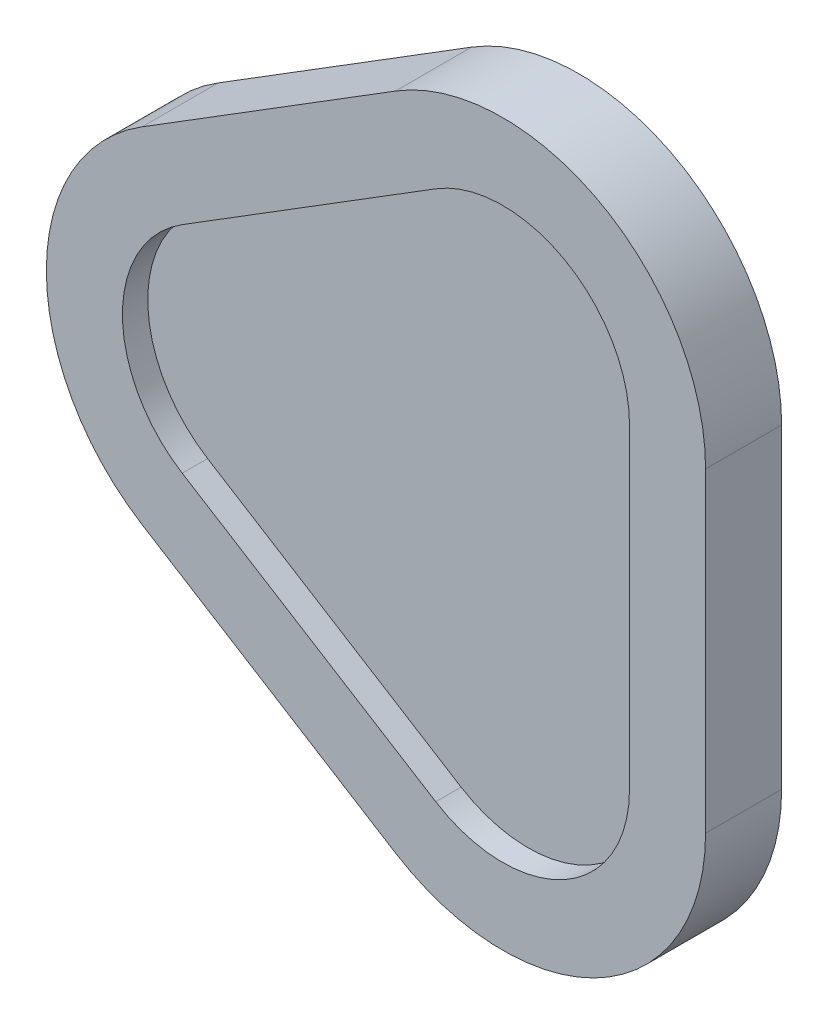
from build123d import *

# Parameters (mm, degrees)
Y_KSEKLIK_EKSTR_ZYON1_DEPTH = 15
BOSS_EXTRUDE1_DEPTH         = 10


with BuildPart() as part:
    # Çizim1 → Yükseklik-Ekstrüzyon1 (new body)
    with BuildSketch(Plane.XY):
        with BuildLine():
            Line((-90.996604912, -49.609404393), (-40.996604912, -80.724218798))
            ThreePointArc((-40.996604912, -80.724218798), (-0.437932375, -81.729892604), (20.137283846, -46.763082981))
            Line((20.137283846, -46.763082981), (20.137283846, 15.466545829))
            ThreePointArc((20.137283846, 15.466545829), (-0.437932375, 50.433355451), (-40.996604912, 49.427681645))
            Line((-40.996604912, 49.427681645), (-90.996604912, 18.31286724))
            ThreePointArc((-90.996604912, 18.31286724), (-109.862716154, -15.648268576), (-90.996604912, -49.609404393))
        make_face()
        with BuildLine():
            Line((-83.071396628, -36.873978462), (-33.071396628, -67.988792867))
            ThreePointArc((-33.071396628, -67.988792867), (-7.722226292, -68.617338995), (5.137283846, -46.763082981))
            Line((5.137283846, -46.763082981), (5.137283846, 15.466545829))
            ThreePointArc((5.137283846, 15.466545829), (-7.722226292, 37.320801843), (-33.071396628, 36.692255714))
            Line((-33.071396628, 36.692255714), (-83.071396628, 5.577441309))
            ThreePointArc((-83.071396628, 5.577441309), (-94.862716154, -15.648268576), (-83.071396628, -36.873978462))
        make_face(mode=Mode.SUBTRACT)
    extrude(amount=Y_KSEKLIK_EKSTR_ZYON1_DEPTH)

    # Çizim1<3> → Boss-Extrude1 (add)
    with BuildSketch(Plane.XY):
        with BuildLine():
            ThreePointArc((-83.071396628, 5.577441309), (-94.862716154, -15.648268576), (-83.071396628, -36.873978462))
            Line((-83.071396628, -36.873978462), (-33.071396628, -67.988792867))
            ThreePointArc((-33.071396628, -67.988792867), (-7.722226292, -68.617338995), (5.137283846, -46.763082981))
            Line((5.137283846, -46.763082981), (5.137283846, 15.466545829))
            ThreePointArc((5.137283846, 15.466545829), (-7.722226292, 37.320801843), (-33.071396628, 36.692255714))
            Line((-33.071396628, 36.692255714), (-83.071396628, 5.577441309))
        make_face()
    extrude(amount=BOSS_EXTRUDE1_DEPTH)


solid = part.part
